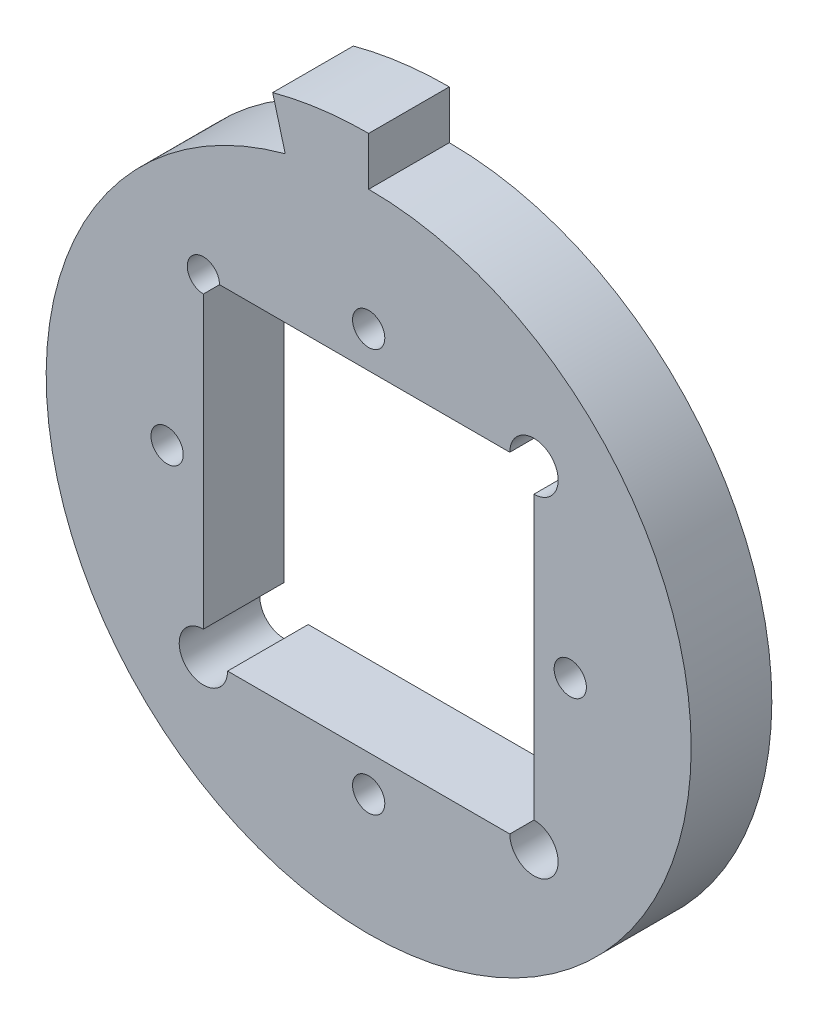
from build123d import *

# Parameters (mm, degrees)
EXTRUDE_1_DEPTH     = 5
SKETCH_2_R          = 1
CUT_EXTRUDE_1_DEPTH = 5


with BuildPart() as part:
    # 草图1 → 凸台-拉伸1 (new body)
    with BuildSketch(Plane.XY):
        with BuildLine():
            ThreePointArc((0, 23), (-3.002102421, 22.803231812), (-5.952838037, 22.216294005))
            Line((-5.952838037, 22.216294005), (-5.176380902, 19.318516526))
            ThreePointArc((-5.176380902, 19.318516526), (2.610523844, -19.828897227), (0, 20))
            Line((0, 20), (0, 23))
        make_face()
        with BuildLine():
            Line((-9.25, 10.25), (8.75, 10.25))
            ThreePointArc((8.75, 10.25), (11.310660172, 11.310660172), (10.25, 8.75))
            Line((10.25, 8.75), (10.25, -8.75))
            ThreePointArc((10.25, -8.75), (11.310660172, -11.310660172), (8.75, -10.25))
            Line((8.75, -10.25), (-8.75, -10.25))
            ThreePointArc((-8.75, -10.25), (-11.310660172, -11.310660172), (-10.25, -8.75))
            Line((-10.25, -8.75), (-10.25, 9.25))
            ThreePointArc((-10.25, 9.25), (-10.957106781, 10.957106781), (-9.25, 10.25))
        make_face(mode=Mode.SUBTRACT)
    extrude(amount=EXTRUDE_1_DEPTH)

    # 草图2 → 切除-拉伸1 (cut)
    with BuildSketch(Plane.XY.offset(5)):
        with Locations((0, 12.5)):
            Circle(SKETCH_2_R)
        with Locations((12.5, 0)):
            Circle(SKETCH_2_R)
        with Locations((0, -12.5)):
            Circle(SKETCH_2_R)
        with Locations((-12.5, 0)):
            Circle(SKETCH_2_R)
    extrude(amount=-CUT_EXTRUDE_1_DEPTH, mode=Mode.SUBTRACT)


solid = part.part
